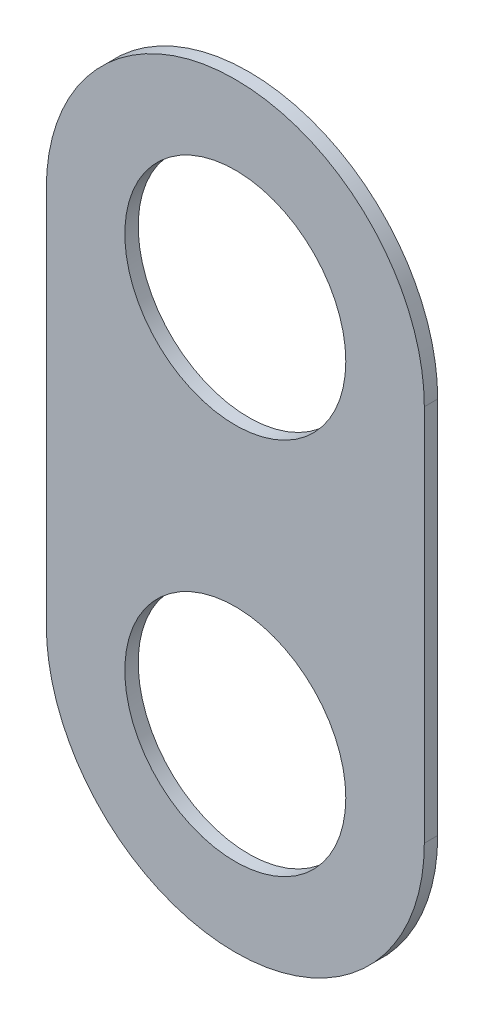
from build123d import *

# Parameters (mm, degrees)
SKETCH1_R           = 11.13536
BOSS_EXTRUDE1_DEPTH = 1.348858601


with BuildPart() as part:
    # Sketch1 → Boss-Extrude1 (new body)
    with BuildSketch(Plane.XY):
        with BuildLine():
            Line((0, 24.798650143), (0, -13.301349857))
            ThreePointArc((0, -13.301349857), (19.05, -32.351349857), (38.1, -13.301349857))
            Line((38.1, -13.301349857), (38.1, 24.798650143))
            ThreePointArc((38.1, 24.798650143), (19.05, 43.848650143), (0, 24.798650143))
        make_face()
        with Locations((19.05, 24.798650143)):
            Circle(SKETCH1_R, mode=Mode.SUBTRACT)
        with Locations((19.05, -13.301349857)):
            Circle(SKETCH1_R, mode=Mode.SUBTRACT)
    extrude(amount=BOSS_EXTRUDE1_DEPTH)


solid = part.part
